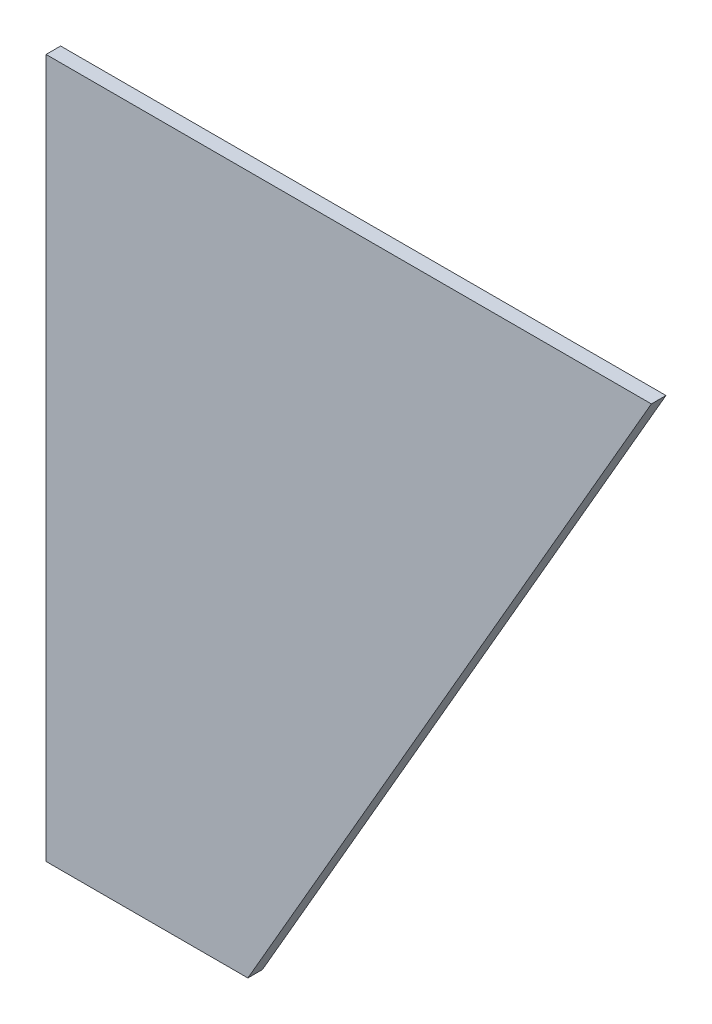
from build123d import *

# Parameters (mm, degrees)
BOSS_EXTRUDE1_DEPTH = 3


with BuildPart() as part:
    # Sketch1 → Boss-Extrude1 (new body)
    with BuildSketch(Plane.XY):
        Polygon((8.238798283, 74.034892704), (-63.181201717, -49.675107296), (-104.681201717, -49.675107296), (-104.681201717, 74.034892704), (-104.681201717, 94.034892704), (19.785156702, 94.034892704), align=None)
    extrude(amount=BOSS_EXTRUDE1_DEPTH)


solid = part.part
